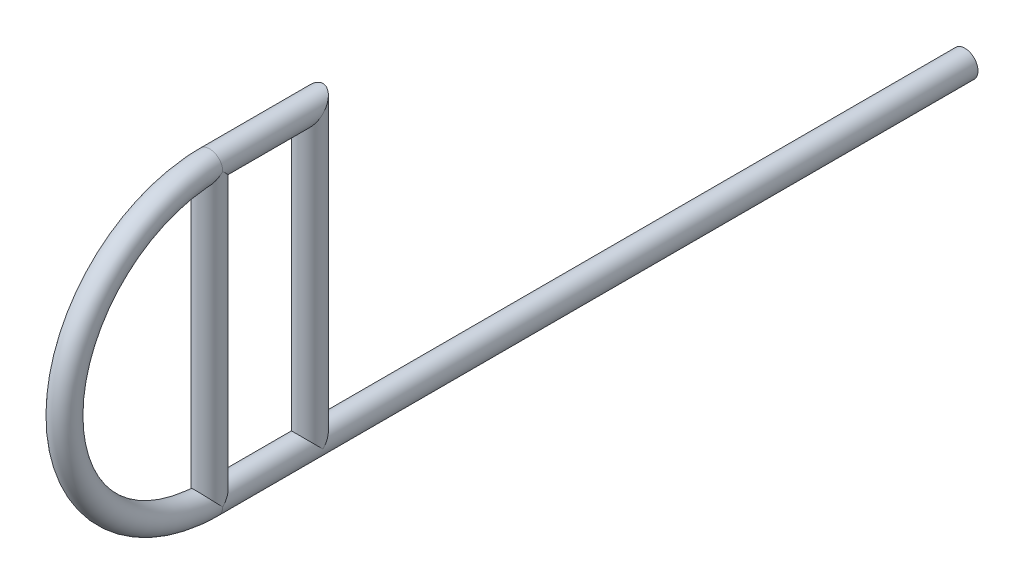
from build123d import *

# Parameters (mm, degrees)
SWEEP1_PROFILE_R        = 45
CUT_EXTRUDE1_DEPTH      = 3315.373998336
CUT_EXTRUDE1_DEPTH_BACK = 3315.373998336
BOSS_EXTRUDE1_REACH     = 3316.374
SKETCH8_R               = 45


with BuildPart() as part:
    # Sweep1: sweep along a path in Sketch1
    with BuildLine(Plane.YZ) as sweep1_path:
        Line((0, 0), (0, 2600))
        ThreePointArc((0, 2600), (500, 3100), (1000, 2600))
        Line((1000, 2600), (1000, 2210))
    # Sweep1 profile (on start of the path) → Sweep1 (sweep)
    with BuildSketch(Plane.XY):
        Circle(SWEEP1_PROFILE_R)
    sweep(path=sweep1_path.line)

    # Sketch9 → Cut-Extrude1 (cut, two sides: drawn at the far end of the back side and taken through both)
    with BuildSketch(Plane.YZ.offset(-CUT_EXTRUDE1_DEPTH_BACK)):
        Polygon((1045, 2210), (955, 2300), (955, 2210), align=None)
    extrude(amount=CUT_EXTRUDE1_DEPTH + CUT_EXTRUDE1_DEPTH_BACK, mode=Mode.SUBTRACT)

    # Sketch8 → Boss-Extrude1 (add, up to next)
    with BuildSketch(Plane(origin=(0, 0, 0), x_dir=(-1, 0, 0), z_dir=(0, 1, 0)), mode=Mode.PRIVATE) as boss_extrude1_sk1:
        with Locations((0, 2600)):
            Circle(SKETCH8_R)
    boss_extrude1_tool1 = extrude(boss_extrude1_sk1.sketch, amount=BOSS_EXTRUDE1_REACH, mode=Mode.PRIVATE) - part.part
    # Sketch8 → Boss-Extrude1 (add, up to next)
    with BuildSketch(Plane(origin=(0, 0, 0), x_dir=(-1, 0, 0), z_dir=(0, 1, 0)), mode=Mode.PRIVATE) as boss_extrude1_sk2:
        with Locations(Location((0, 2255, 0), (0, 0, 180))):
            Circle(SKETCH8_R)
    boss_extrude1_tool2 = extrude(boss_extrude1_sk2.sketch, amount=BOSS_EXTRUDE1_REACH, mode=Mode.PRIVATE) - part.part
    add(boss_extrude1_tool1.solids().sort_by_distance((0, 0, 2600))[0])
    add(boss_extrude1_tool2.solids().sort_by_distance((0, 0, 2255))[0])


solid = part.part
